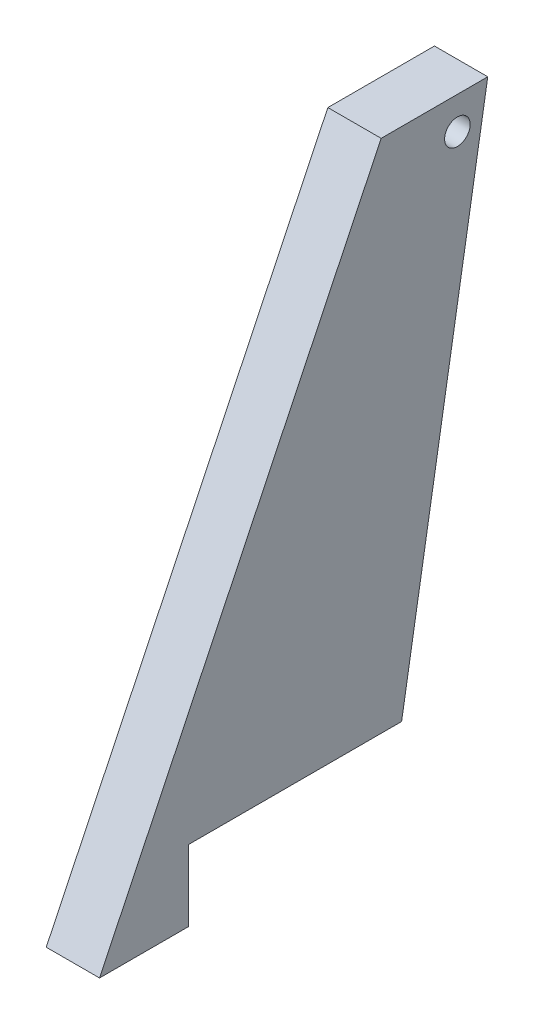
from build123d import *

# Parameters (mm, degrees)
BOSS_EXTRUDE1_DEPTH = 9.525
SKETCH2_R           = 2.286
CUT_EXTRUDE1_DEPTH  = 119.026209144


with BuildPart() as part:
    # Sketch1 → Boss-Extrude1 (new body)
    with BuildSketch(Plane(origin=(0, 0, 0), x_dir=(0, 0, -1), z_dir=(1, 0, 0))):
        Polygon((0, 0), (-15.875, 0), (34.444483781, 104.775), (53.494483781, 104.775), (38.1, 12.7), (0, 12.7), align=None)
    extrude(amount=BOSS_EXTRUDE1_DEPTH)

    # Sketch2 → Cut-Extrude1 (cut, through all)
    with BuildSketch(Plane.ZY):
        with Locations((-48.067162249, 98.988640316)):
            Circle(SKETCH2_R)
    extrude(amount=-CUT_EXTRUDE1_DEPTH, mode=Mode.SUBTRACT)


solid = part.part
